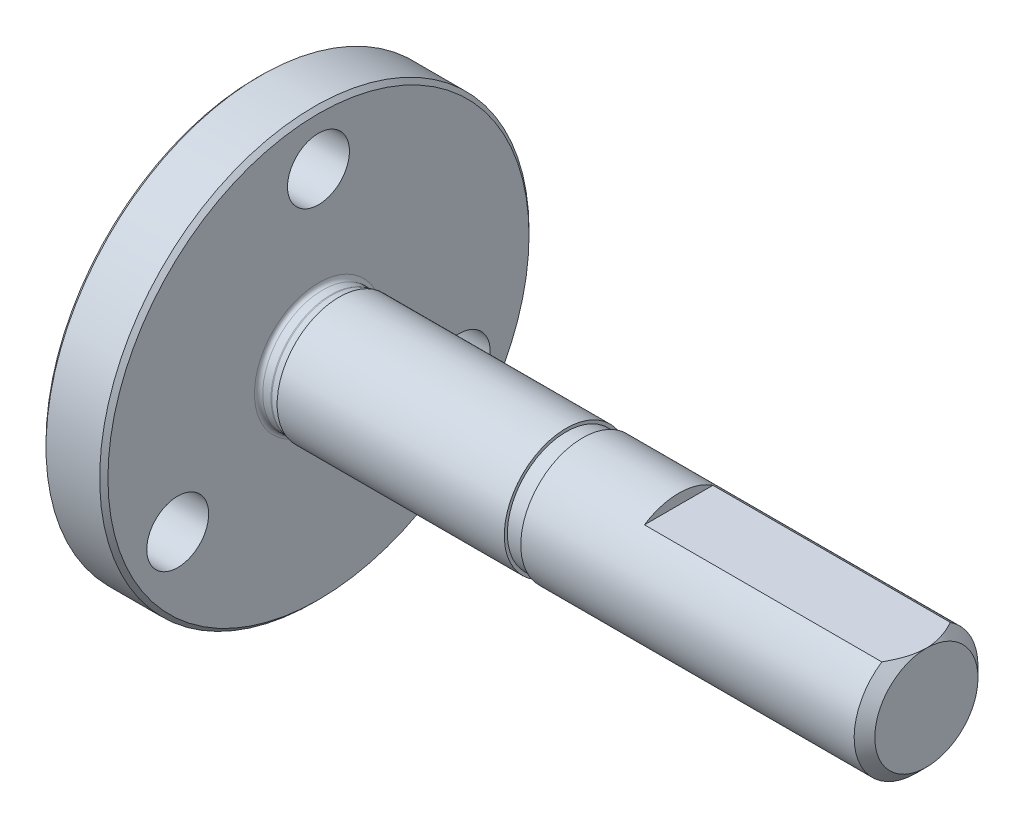
from build123d import *
from OCP.BRepFilletAPI import BRepFilletAPI_MakeChamfer

# Parameters (mm, degrees)
DIAM_TRE_DU_PER_AGE_3_0_3_1_D     = 3
DIAM_TRE_DU_PER_AGE_3_0_3_1_DEPTH = 32.45
CHANFREIN1_SIZE                   = 0.5
CHANFREIN2_SIZE                   = 0.2
CHANFREIN3_SIZE                   = 0.173205081
CHANFREIN3_SIZE2                  = 0.3
CHANFREIN4_SIZE                   = 0.3
CHANFREIN4_SIZE2                  = 0.173205081
CONG_1_R                          = 0.2
ESQUISSE6_W                       = 8
ESQUISSE6_H                       = 1.5
ENL_V_MAT_EXTRU_1_DEPTH           = 12


with BuildPart() as part:
    # Esquisse1 → Révolution1 (revolve)
    with BuildSketch(Plane.XY, mode=Mode.PRIVATE) as r_volution1_sk:
        Polygon((-3, 10.4), (-3, 0), (29.45, 0), (29.45, 3), (12.8, 3), (12.8, 2.85), (12, 2.85), (12, 3), (0.996794919, 3), (0.623589838, 2.9), (0, 2.9), (0, 10.4), align=None)
    revolve(r_volution1_sk.sketch.rotate(Axis((-3, 0, 0), (1, 0, 0)), 270), axis=Axis((-3, 0, 0), (1, 0, 0)))

    # Diamètre du perçage Ø3.0 (3)1
    with Locations(Plane.ZY.offset(3)):
        with Locations((-6.819950055, -3.9375), (6.819950055, -3.9375), (0, 7.875)):
            Hole(DIAM_TRE_DU_PER_AGE_3_0_3_1_D / 2, depth=DIAM_TRE_DU_PER_AGE_3_0_3_1_DEPTH)

    # Esquisse4 → Perçage1 (revolve, cut)
    with BuildSketch(Plane(origin=(-3, 0, 0), x_dir=(0, 0, 1), z_dir=(0, 1, 0))):
        Polygon((0, 0), (0, 0.5), (4.866025404, 0.5), (5, 0), align=None)
    revolve(axis=Axis((107, 0, 0), (-1, 0, 0)), mode=Mode.SUBTRACT)

    # Chanfrein1
    chanfrein1_edges = [part.edges().sort_by_distance(p)[0] for p in [
        (29.45, 0, 3),
    ]]
    chamfer(chanfrein1_edges, length=CHANFREIN1_SIZE)

    # Chanfrein2
    chanfrein2_edges = [part.edges().sort_by_distance(p)[0] for p in [
        (-3, 0, 10.4),
        (0, 0, 10.4),
    ]]
    chamfer(chanfrein2_edges, length=CHANFREIN2_SIZE)

    # Chanfrein3
    chanfrein3_edges = [part.edges().sort_by_distance(p)[0] for p in [
        (-3, 7.875, 1.5),
    ]]
    chanfrein3_side = [part.faces().sort_by_distance(p)[0] for p in [
        (-3, 0, 9.911500433),
    ]]
    chamfer(chanfrein3_edges, length=CHANFREIN3_SIZE, length2=CHANFREIN3_SIZE2, reference=chanfrein3_side[0])

    # Chanfrein4: one chamfer whose edges measure the first distance from different faces: ONE call of the kernel's chamfer builder (chamfer() names one face for all edges)
    chanfrein4_edges_1 = [part.edges().sort_by_distance(p)[0] for p in [
        (-3, -3.9375, 8.319950055),
    ]]
    chanfrein4_side_1 = [part.faces().sort_by_distance(p)[0] for p in [
        (-1.5, -3.9375, 8.319950055),
    ]]
    chanfrein4_edges_2 = [part.edges().sort_by_distance(p)[0] for p in [
        (-3, -3.9375, -5.319950055),
    ]]
    chanfrein4_side_2 = [part.faces().sort_by_distance(p)[0] for p in [
        (-1.5, -3.9375, -5.319950055),
    ]]
    chanfrein4 = BRepFilletAPI_MakeChamfer(part.part.solid().wrapped)
    for e in chanfrein4_edges_1:
        chanfrein4.Add(CHANFREIN4_SIZE, CHANFREIN4_SIZE2, e.wrapped, chanfrein4_side_1[0].wrapped)  # the first distance lies on this face
    for e in chanfrein4_edges_2:
        chanfrein4.Add(CHANFREIN4_SIZE, CHANFREIN4_SIZE2, e.wrapped, chanfrein4_side_2[0].wrapped)  # the first distance lies on this face
    add(Compound.cast(chanfrein4.Shape()), mode=Mode.REPLACE)

    # Congé1
    cong_1_edges = [part.edges().sort_by_distance(p)[0] for p in [
        (0, 0, 2.9),
        (0.623589838, 0, 2.9),
    ]]
    fillet(cong_1_edges, radius=CONG_1_R)

    # Esquisse6 → Enlèv. mat.-Extru.1 (cut)
    with BuildSketch(Plane(origin=(29.45, 0, 0), x_dir=(0, 0, -1), z_dir=(1, 0, 0))):
        with Locations((0, 3.25)):
            Rectangle(ESQUISSE6_W, ESQUISSE6_H)
    extrude(amount=-ENL_V_MAT_EXTRU_1_DEPTH, mode=Mode.SUBTRACT)


solid = part.part
